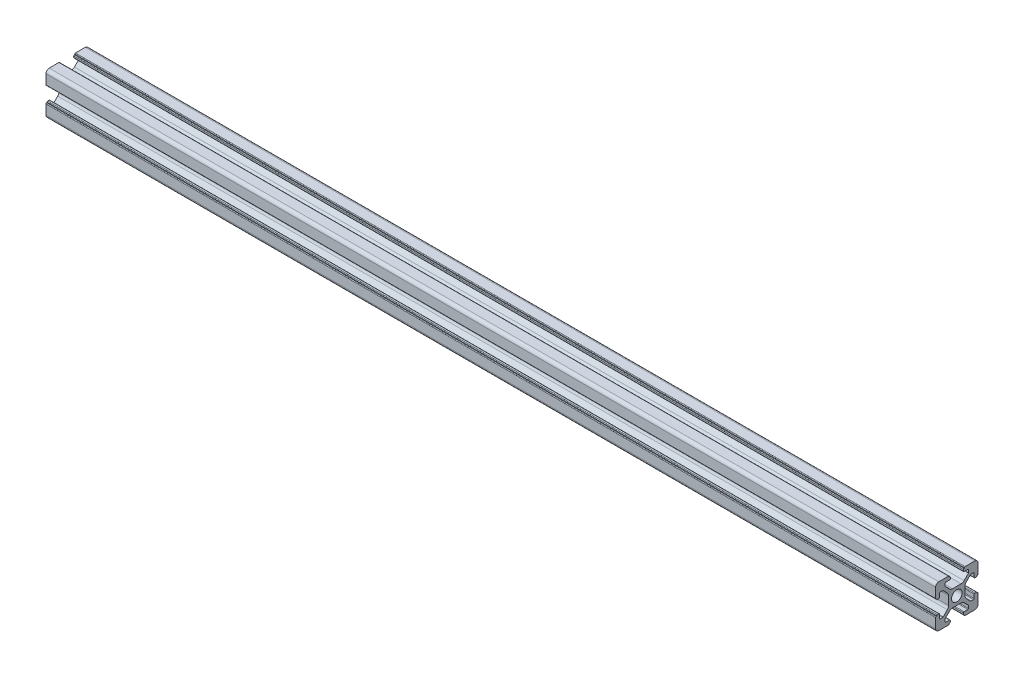
from build123d import *

# Parameters (mm, degrees)
SKETCH_11_R         = 2.5
MEMBER_2020_1_DEPTH = 420


with BuildPart() as part:
    # 草图11 → Member 2020_1 (new body)
    with BuildSketch(Plane.YZ.offset(-210)):
        with BuildLine():
            Line((3.9, 0), (3.9, -2.010912703))
            ThreePointArc((3.9, -2.010912703), (4.052240935, -2.776279568), (4.485786438, -3.425126266))
            Line((4.485786438, -3.425126266), (6.560660172, -5.5))
            Line((6.560660172, -5.5), (7.9, -5.5))
            ThreePointArc((7.9, -5.5), (8.112132034, -5.412132034), (8.2, -5.2))
            Line((8.2, -5.2), (8.2, -3.4))
            ThreePointArc((8.2, -3.4), (8.287867966, -3.187867966), (8.5, -3.1))
            Line((8.5, -3.1), (9.2, -3.1))
            ThreePointArc((9.2, -3.1), (9.412132034, -3.187867966), (9.5, -3.4))
            Line((9.5, -3.4), (9.5, -3.6))
            Line((9.5, -3.6), (9.7, -3.6))
            ThreePointArc((9.7, -3.6), (9.912132034, -3.687867966), (10, -3.9))
            Line((10, -3.9), (10, -8.5))
            ThreePointArc((10, -8.5), (9.560660172, -9.560660172), (8.5, -10))
            Line((8.5, -10), (3.9, -10))
            ThreePointArc((3.9, -10), (3.687867966, -9.912132034), (3.6, -9.7))
            ThreePointArc((3.6, -9.7), (3.541421356, -9.558578644), (3.4, -9.5))
            ThreePointArc((3.4, -9.5), (3.187867966, -9.412132034), (3.1, -9.2))
            Line((3.1, -9.2), (3.1, -8.5))
            ThreePointArc((3.1, -8.5), (3.187867966, -8.287867966), (3.4, -8.2))
            Line((3.4, -8.2), (5.2, -8.2))
            ThreePointArc((5.2, -8.2), (5.412132034, -8.112132034), (5.5, -7.9))
            Line((5.5, -7.9), (5.5, -6.68492424))
            ThreePointArc((5.5, -6.68492424), (5.47716386, -6.570119211), (5.412132034, -6.472792206))
            Line((5.412132034, -6.472792206), (3.425126266, -4.485786438))
            ThreePointArc((3.425126266, -4.485786438), (2.776279568, -4.052240935), (2.010912703, -3.9))
            Line((2.010912703, -3.9), (0, -3.9))
            Line((0, -3.9), (-2.010912703, -3.9))
            ThreePointArc((-2.010912703, -3.9), (-2.776279568, -4.052240935), (-3.425126266, -4.485786438))
            Line((-3.425126266, -4.485786438), (-5.412132034, -6.472792206))
            ThreePointArc((-5.412132034, -6.472792206), (-5.47716386, -6.570119211), (-5.5, -6.68492424))
            Line((-5.5, -6.68492424), (-5.5, -7.9))
            ThreePointArc((-5.5, -7.9), (-5.412132034, -8.112132034), (-5.2, -8.2))
            Line((-5.2, -8.2), (-3.4, -8.2))
            ThreePointArc((-3.4, -8.2), (-3.187867966, -8.287867966), (-3.1, -8.5))
            Line((-3.1, -8.5), (-3.1, -9.2))
            ThreePointArc((-3.1, -9.2), (-3.187867966, -9.412132034), (-3.4, -9.5))
            ThreePointArc((-3.4, -9.5), (-3.541421356, -9.558578644), (-3.6, -9.7))
            ThreePointArc((-3.6, -9.7), (-3.687867966, -9.912132034), (-3.9, -10))
            Line((-3.9, -10), (-8.5, -10))
            ThreePointArc((-8.5, -10), (-9.560660172, -9.560660172), (-10, -8.5))
            Line((-10, -8.5), (-10, -3.9))
            ThreePointArc((-10, -3.9), (-9.912132034, -3.687867966), (-9.7, -3.6))
            Line((-9.7, -3.6), (-9.5, -3.6))
            Line((-9.5, -3.6), (-9.5, -3.4))
            ThreePointArc((-9.5, -3.4), (-9.412132034, -3.187867966), (-9.2, -3.1))
            Line((-9.2, -3.1), (-8.5, -3.1))
            ThreePointArc((-8.5, -3.1), (-8.287867965, -3.187867966), (-8.2, -3.4))
            Line((-8.2, -3.4), (-8.2, -5.2))
            ThreePointArc((-8.2, -5.2), (-8.112132034, -5.412132034), (-7.9, -5.5))
            Line((-7.9, -5.5), (-6.68492424, -5.5))
            ThreePointArc((-6.68492424, -5.5), (-6.570119211, -5.47716386), (-6.472792206, -5.412132034))
            Line((-6.472792206, -5.412132034), (-4.485786438, -3.425126266))
            ThreePointArc((-4.485786438, -3.425126266), (-4.052240935, -2.776279568), (-3.9, -2.010912703))
            Line((-3.9, -2.010912703), (-3.9, 0))
            Line((-3.9, 0), (-3.9, 2.010912703))
            ThreePointArc((-3.9, 2.010912703), (-4.052240935, 2.776279568), (-4.485786438, 3.425126266))
            Line((-4.485786438, 3.425126266), (-6.472792206, 5.412132034))
            ThreePointArc((-6.472792206, 5.412132034), (-6.570119211, 5.47716386), (-6.68492424, 5.5))
            Line((-6.68492424, 5.5), (-7.9, 5.5))
            ThreePointArc((-7.9, 5.5), (-8.112132034, 5.412132034), (-8.2, 5.2))
            Line((-8.2, 5.2), (-8.2, 3.4))
            ThreePointArc((-8.2, 3.4), (-8.287867965, 3.187867966), (-8.5, 3.1))
            Line((-8.5, 3.1), (-9.2, 3.1))
            ThreePointArc((-9.2, 3.1), (-9.412132034, 3.187867966), (-9.5, 3.4))
            Line((-9.5, 3.4), (-9.5, 3.6))
            Line((-9.5, 3.6), (-9.7, 3.6))
            ThreePointArc((-9.7, 3.6), (-9.912132034, 3.687867966), (-10, 3.9))
            Line((-10, 3.9), (-10, 8.5))
            ThreePointArc((-10, 8.5), (-9.560660172, 9.560660172), (-8.5, 10))
            Line((-8.5, 10), (-3.9, 10))
            ThreePointArc((-3.9, 10), (-3.687867966, 9.912132034), (-3.6, 9.7))
            Line((-3.6, 9.7), (-3.6, 9.5))
            Line((-3.6, 9.5), (-3.4, 9.5))
            ThreePointArc((-3.4, 9.5), (-3.187867966, 9.412132034), (-3.1, 9.2))
            Line((-3.1, 9.2), (-3.1, 8.5))
            ThreePointArc((-3.1, 8.5), (-3.187867966, 8.287867966), (-3.4, 8.2))
            Line((-3.4, 8.2), (-5.2, 8.2))
            ThreePointArc((-5.2, 8.2), (-5.412132034, 8.112132034), (-5.5, 7.9))
            Line((-5.5, 7.9), (-5.5, 6.68492424))
            ThreePointArc((-5.5, 6.68492424), (-5.47716386, 6.570119211), (-5.412132034, 6.472792206))
            Line((-5.412132034, 6.472792206), (-3.425126266, 4.485786438))
            ThreePointArc((-3.425126266, 4.485786438), (-2.776279568, 4.052240935), (-2.010912703, 3.9))
            Line((-2.010912703, 3.9), (0, 3.9))
            Line((0, 3.9), (2.010912703, 3.9))
            ThreePointArc((2.010912703, 3.9), (2.776279568, 4.052240935), (3.425126266, 4.485786438))
            Line((3.425126266, 4.485786438), (5.412132034, 6.472792206))
            ThreePointArc((5.412132034, 6.472792206), (5.47716386, 6.570119211), (5.5, 6.68492424))
            Line((5.5, 6.68492424), (5.5, 7.9))
            ThreePointArc((5.5, 7.9), (5.412132034, 8.112132034), (5.2, 8.2))
            Line((5.2, 8.2), (3.4, 8.2))
            ThreePointArc((3.4, 8.2), (3.187867966, 8.287867966), (3.1, 8.5))
            Line((3.1, 8.5), (3.1, 9.2))
            ThreePointArc((3.1, 9.2), (3.187867966, 9.412132034), (3.4, 9.5))
            Line((3.4, 9.5), (3.6, 9.5))
            Line((3.6, 9.5), (3.6, 9.7))
            ThreePointArc((3.6, 9.7), (3.687867966, 9.912132034), (3.9, 10))
            Line((3.9, 10), (8.5, 10))
            ThreePointArc((8.5, 10), (9.560660172, 9.560660172), (10, 8.5))
            Line((10, 8.5), (10, 3.9))
            ThreePointArc((10, 3.9), (9.912132034, 3.687867966), (9.7, 3.6))
            Line((9.7, 3.6), (9.5, 3.6))
            Line((9.5, 3.6), (9.5, 3.4))
            ThreePointArc((9.5, 3.4), (9.412132034, 3.187867966), (9.2, 3.1))
            Line((9.2, 3.1), (8.5, 3.1))
            ThreePointArc((8.5, 3.1), (8.287867966, 3.187867966), (8.2, 3.4))
            Line((8.2, 3.4), (8.2, 5.2))
            ThreePointArc((8.2, 5.2), (8.112132034, 5.412132034), (7.9, 5.5))
            Line((7.9, 5.5), (6.68492424, 5.5))
            ThreePointArc((6.68492424, 5.5), (6.570119211, 5.47716386), (6.472792206, 5.412132034))
            Line((6.472792206, 5.412132034), (4.485786438, 3.425126266))
            ThreePointArc((4.485786438, 3.425126266), (4.052240935, 2.776279568), (3.9, 2.010912703))
            Line((3.9, 2.010912703), (3.9, 0))
        make_face()
        Circle(SKETCH_11_R, mode=Mode.SUBTRACT)
    extrude(amount=MEMBER_2020_1_DEPTH)


solid = part.part
